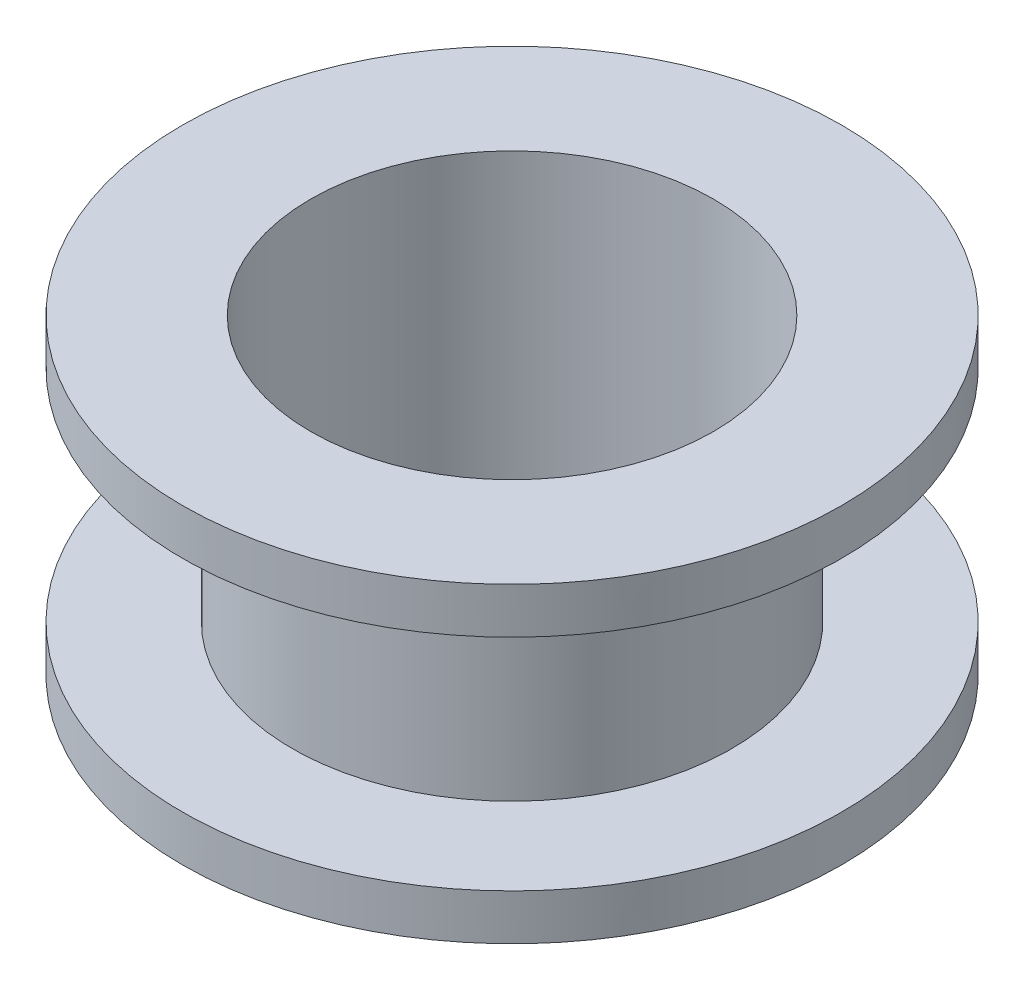
from build123d import *

# Parameters (mm, degrees)
SKETCH1_R           = 9
SKETCH1_R_2         = 5.5
BOSS_EXTRUDE1_DEPTH = 8.5
SKETCH4_W           = 3
SKETCH4_H           = 6


with BuildPart() as part:
    # Sketch1 → Boss-Extrude1 (new body)
    with BuildSketch(Plane(origin=(0, 0, 0), x_dir=(1, 0, 0), z_dir=(0, 1, 0))):
        with Locations(Location((0, 0, 0), (0, 0, 270))):
            Circle(SKETCH1_R)
        with Locations(Location((0, 0, 0), (0, 0, 270))):
            Circle(SKETCH1_R_2, mode=Mode.SUBTRACT)
    extrude(amount=BOSS_EXTRUDE1_DEPTH)

    # Sketch4 → Cut-Revolve1 (revolve, cut)
    with BuildSketch(Plane.XY, mode=Mode.PRIVATE) as cut_revolve1_sk:
        with Locations((7.5, 4.25)):
            Rectangle(SKETCH4_W, SKETCH4_H)
    revolve(cut_revolve1_sk.sketch.rotate(Axis((0, 0, 0), (0, 1, 0)), 90), axis=Axis((0, 0, 0), (0, 1, 0)), mode=Mode.SUBTRACT)


solid = part.part
